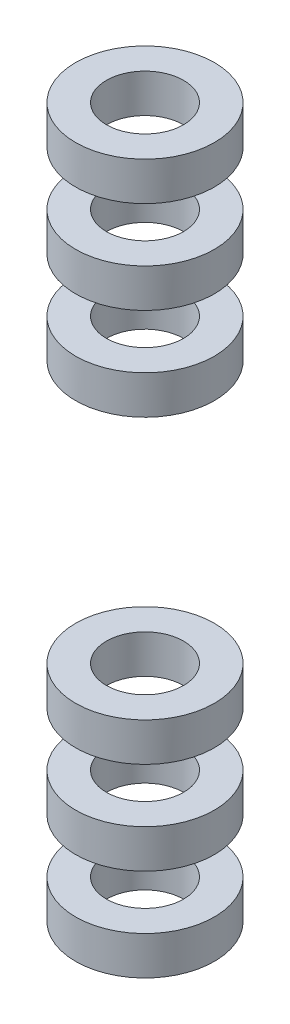
from build123d import *

# Parameters (mm, degrees)
SKETCH_1_R               = 45
SKETCH_1_R_2             = 25
EXTRUDE_2_DEPTH          = 460
CUT_EXTRUDE_1_DEPTH      = 154
CUT_EXTRUDE_1_DEPTH_BACK = 248
SKETCH_2_W               = 90
SKETCH_2_H               = 35
SKETCH_2_H_2             = 170


with BuildPart() as part:
    # 草图1 → 凸台-拉伸2 (new body)
    with BuildSketch(Plane(origin=(0, 0, 0), x_dir=(1, 0, 0), z_dir=(0, 1, 0))):
        with Locations(Location((0, 0, 0), (0, 0, 270))):
            Circle(SKETCH_1_R)
        with Locations(Location((0, 0, 0), (0, 0, 270))):
            Circle(SKETCH_1_R_2, mode=Mode.SUBTRACT)
    extrude(amount=EXTRUDE_2_DEPTH)

    # 草图2 → 切除-拉伸1 (cut, two sides: drawn at the far end of the back side and taken through both)
    with BuildSketch(Plane.XY.offset(-CUT_EXTRUDE_1_DEPTH_BACK)):
        with Locations((0, 417.5)):
            Rectangle(SKETCH_2_W, SKETCH_2_H)
        with Locations((0, 357.5)):
            Rectangle(SKETCH_2_W, SKETCH_2_H)
        with Locations((0, 230)):
            Rectangle(SKETCH_2_W, SKETCH_2_H_2)
        with Locations((0, 102.5)):
            Rectangle(SKETCH_2_W, SKETCH_2_H)
        with Locations((0, 42.5)):
            Rectangle(SKETCH_2_W, SKETCH_2_H)
    extrude(amount=CUT_EXTRUDE_1_DEPTH + CUT_EXTRUDE_1_DEPTH_BACK, mode=Mode.SUBTRACT)


with BuildPart() as cut_extrude_1_piece_1:
    # of the separate pieces the step leaves, piece 1, a body of its own (cut_extrude_1_pieces)
    add(part.part.solids().sort_by_distance((0, 120, 45))[0])


with BuildPart() as cut_extrude_1_piece_2:
    # of the separate pieces the step leaves, piece 2, a body of its own (cut_extrude_1_pieces)
    add(part.part.solids().sort_by_distance((0, 60, 45))[0])


with BuildPart() as cut_extrude_1_piece_3:
    # of the separate pieces the step leaves, piece 3, a body of its own (cut_extrude_1_pieces)
    add(part.part.solids().sort_by_distance((0, 435, 45))[0])


with BuildPart() as cut_extrude_1_piece_4:
    # of the separate pieces the step leaves, piece 4, a body of its own (cut_extrude_1_pieces)
    add(part.part.solids().sort_by_distance((0, 315, 45))[0])


with BuildPart() as cut_extrude_1_piece_5:
    # of the separate pieces the step leaves, piece 5, a body of its own (cut_extrude_1_pieces)
    add(part.part.solids().sort_by_distance((0, 375, 45))[0])


with BuildPart() as cut_extrude_1_piece_6:
    # of the separate pieces the step leaves, piece 6, a body of its own (cut_extrude_1_pieces)
    add(part.part.solids().sort_by_distance((0, 0, 45))[0])


solid = Compound([cut_extrude_1_piece_1.part, cut_extrude_1_piece_2.part, cut_extrude_1_piece_3.part, cut_extrude_1_piece_4.part, cut_extrude_1_piece_5.part, cut_extrude_1_piece_6.part])
